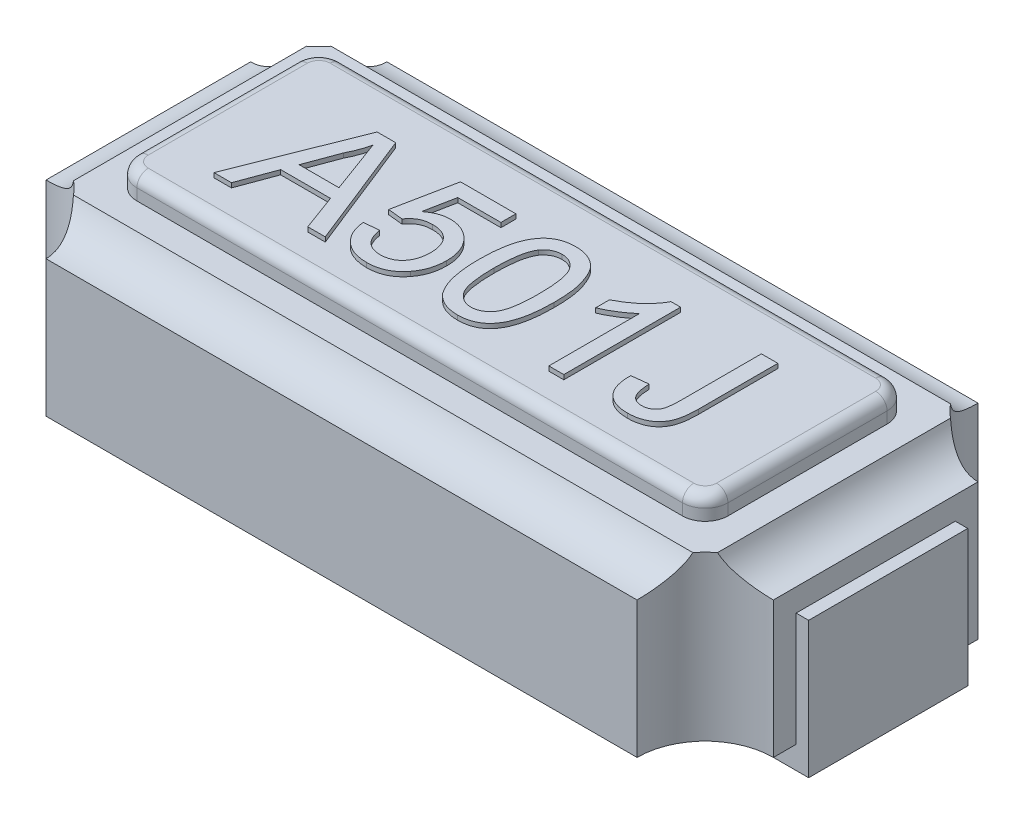
from build123d import *

# Parameters (mm, degrees)
EXTRUDE_1_DEPTH        = 0.8
EXTRUDE_START          = -1.6
SKETCH_3_R             = 0.2
EXTRUDE_4_DEPTH        = 3.2
EXTRUDE_START_2        = -0.75
SKETCH_4_R             = 0.2
EXTRUDE_5_DEPTH        = 1.5
PATTERN_LINEAR_3_COUNT = 2
PATTERN_LINEAR_3_PITCH = 1.5
PATTERN_LINEAR_4_COUNT = 2
PATTERN_LINEAR_4_PITCH = 3.2
SKETCH_5_W             = 0.8
SKETCH_5_H             = 0.7
EXTRUDE_6_DEPTH        = 0.6
EXTRUDE_6_2_DEPTH      = 0.6
SKETCH_5_2_W           = 0.8
SKETCH_5_2_H           = 0.7
EXTRUDE_7_DEPTH        = 0.6
EXTRUDE_7_2_DEPTH      = 0.6
SKETCH_6_W             = 2.9
SKETCH_6_H             = 1.2
EXTRUDE_8_DEPTH        = 0.08
EXTRUDE_9_DEPTH        = 0.1
EXTRUDE_10_DEPTH       = 0.02
EXTRUDE_10_2_DEPTH     = 0.02
EXTRUDE_10_3_DEPTH     = 0.02
EXTRUDE_10_4_DEPTH     = 0.02
EXTRUDE_10_5_DEPTH     = 0.02
FILLET_1_R             = 0.05


with BuildPart() as part:
    # Эскиз1 → Бобышка-Вытянуть1 (new body)
    with BuildSketch(Plane(origin=(0, 0.1, 0), x_dir=(1, 0, 0), z_dir=(0, 1, 0))):
        with BuildLine():
            Line((-1.3, 0.75), (1.3, 0.75))
            ThreePointArc((1.3, 0.75), (1.387867966, 0.537867966), (1.6, 0.45))
            Line((1.6, 0.45), (1.6, -0.45))
            ThreePointArc((1.6, -0.45), (1.387867966, -0.537867966), (1.3, -0.75))
            Line((1.3, -0.75), (-1.3, -0.75))
            ThreePointArc((-1.3, -0.75), (-1.387867966, -0.537867966), (-1.6, -0.45))
            Line((-1.6, -0.45), (-1.6, 0.45))
            ThreePointArc((-1.6, 0.45), (-1.387867966, 0.537867966), (-1.3, 0.75))
        make_face()
    extrude(amount=EXTRUDE_1_DEPTH)


with BuildPart() as body_2:
    # Эскиз3 → Бобышка-Вытянуть4 (new body)
    with BuildSketch(Plane(origin=(0, 0, 0), x_dir=(0, 0, -1), z_dir=(1, 0, 0)).offset(EXTRUDE_START)):
        with Locations((-0.75, 0.9)):
            Circle(SKETCH_3_R)
    extrude_4 = extrude(amount=EXTRUDE_4_DEPTH)


with BuildPart() as body_3:
    # Эскиз4 → Бобышка-Вытянуть5 (new body)
    with BuildSketch(Plane.XY.offset(EXTRUDE_START_2)):
        with Locations((1.6, 0.9)):
            Circle(SKETCH_4_R)
    extrude_5 = extrude(amount=EXTRUDE_5_DEPTH)


with BuildPart() as pattern_linear_3_1:
    # Линейный массив3: Бобышка-Вытянуть4 ×2
    with Locations(*[(0, 0, -i * PATTERN_LINEAR_3_PITCH) for i in range(1, PATTERN_LINEAR_3_COUNT)]):
        add(extrude_4)


with BuildPart() as pattern_linear_4_1:
    # Линейный массив4: Бобышка-Вытянуть5 ×2
    with Locations(*[(-i * PATTERN_LINEAR_4_PITCH, 0, 0) for i in range(1, PATTERN_LINEAR_4_COUNT)]):
        add(extrude_5)


with BuildPart() as part_1:
    add(part.part)

    # Combine 1: cut body 2, Линейный массив4_1, Линейный массив3_1, body 3
    add(body_2.part, mode=Mode.SUBTRACT)
    add(pattern_linear_4_1.part, mode=Mode.SUBTRACT)
    add(pattern_linear_3_1.part, mode=Mode.SUBTRACT)
    add(body_3.part, mode=Mode.SUBTRACT)


with BuildPart() as body_2_2:
    # Эскиз5 → Бобышка-Вытянуть6 (new body)
    with BuildSketch(Plane(origin=(0, 0, 0), x_dir=(1, 0, 0), z_dir=(0, 1, 0))):
        with Locations((1.255, 0)):
            Rectangle(SKETCH_5_W, SKETCH_5_H)
    extrude(amount=EXTRUDE_6_DEPTH)


with BuildPart() as body_3_2:
    # Эскиз5 → Extrude 6 2 (new body)
    with BuildSketch(Plane(origin=(0, 0, 0), x_dir=(1, 0, 0), z_dir=(0, 1, 0))):
        with Locations((-1.255, 0)):
            Rectangle(SKETCH_5_W, SKETCH_5_H)
    extrude(amount=EXTRUDE_6_2_DEPTH)


with BuildPart() as part_2:
    add(part_1.part)

    # Combine 2: cut body 3 2, body 2 2
    add(body_3_2.part, mode=Mode.SUBTRACT)
    add(body_2_2.part, mode=Mode.SUBTRACT)


with BuildPart() as body_2_3:
    # Эскиз5<2> → Бобышка-Вытянуть7 (new body)
    with BuildSketch(Plane(origin=(0, 0, 0), x_dir=(1, 0, 0), z_dir=(0, 1, 0))):
        with Locations((1.255, 0)):
            Rectangle(SKETCH_5_2_W, SKETCH_5_2_H)
    extrude(amount=EXTRUDE_7_DEPTH)


with BuildPart() as body_3_3:
    # Эскиз5<2> → Extrude 7 2 (new body)
    with BuildSketch(Plane(origin=(0, 0, 0), x_dir=(1, 0, 0), z_dir=(0, 1, 0))):
        with Locations((-1.255, 0)):
            Rectangle(SKETCH_5_2_W, SKETCH_5_2_H)
    extrude(amount=EXTRUDE_7_2_DEPTH)


with BuildPart() as body_4:
    # Эскиз6 → Бобышка-Вытянуть8 (new body)
    with BuildSketch(Plane(origin=(0, 0.9, 0), x_dir=(1, 0, 0), z_dir=(0, 1, 0))):
        Rectangle(SKETCH_6_W, SKETCH_6_H)
    extrude(amount=-EXTRUDE_8_DEPTH)


with BuildPart() as part_3:
    add(part_2.part)

    # Combine 3: cut body 4
    add(body_4.part, mode=Mode.SUBTRACT)


with BuildPart() as body_4_2:
    # Эскиз7 → Бобышка-Вытянуть9 (new body)
    with BuildSketch(Plane(origin=(0, 0.82, 0), x_dir=(1, 0, 0), z_dir=(0, 1, 0))):
        with BuildLine():
            Line((-1.2, 0.45), (1.2, 0.45))
            ThreePointArc((1.2, 0.45), (1.270710678, 0.420710678), (1.3, 0.35))
            Line((1.3, 0.35), (1.3, -0.35))
            ThreePointArc((1.3, -0.35), (1.270710678, -0.420710678), (1.2, -0.45))
            Line((1.2, -0.45), (-1.2, -0.45))
            ThreePointArc((-1.2, -0.45), (-1.270710678, -0.420710678), (-1.3, -0.35))
            Line((-1.3, -0.35), (-1.3, 0.35))
            ThreePointArc((-1.3, 0.35), (-1.270710678, 0.420710678), (-1.2, 0.45))
        make_face()
    extrude(amount=EXTRUDE_9_DEPTH)

    # Скругление1
    fillet_1_edges = [body_4_2.edges().sort_by_distance(p)[0] for p in [
        (-1.3, 0.92, 0),
        (-1.270710678, 0.92, -0.420710678),
        (0, 0.92, -0.45),
        (1.270710678, 0.92, -0.420710678),
        (1.3, 0.92, 0),
        (1.270710678, 0.92, 0.420710678),
        (0, 0.92, 0.45),
        (-1.270710678, 0.92, 0.420710678),
    ]]
    fillet(fillet_1_edges, radius=FILLET_1_R)


with BuildPart() as body_5:
    # Эскиз8 → Бобышка-Вытянуть10 (new body)
    with BuildSketch(Plane(origin=(0, 0.92, 0), x_dir=(1, 0, 0), z_dir=(0, 1, 0))):
        Polygon((-1.018581196, -0.292372642), (-0.814638583, 0.221291095), (-0.732938061, 0.221291095), (-0.528995447, -0.292372642), (-0.605859792, -0.292372642), (-0.664305506, -0.134322262), (-0.883271137, -0.134322262), (-0.941716851, -0.292372642), align=None)
        with BuildLine():
            Line((-0.861456892, -0.075053369), (-0.686119751, -0.075053369))
            Line((-0.686119751, -0.075053369), (-0.736024982, 0.059947998))
            add(Edge.make_bspline(
                [(-0.736024982, 0.059947998), (-0.73793817, 0.065164267), (-0.741678815, 0.075363057), (-0.747257243, 0.090181039), (-0.752353605, 0.104252802), (-0.757351006, 0.117376579), (-0.761862249, 0.129743004), (-0.766020378, 0.141268549), (-0.770132732, 0.151873106), (-0.772600614, 0.158724742), (-0.773788322, 0.162022202)],
                knots=[0, 0, 0, 0, 1.225184869, 2.395467751, 3.491410812, 4.525364584, 5.492066482, 6.394148129, 7.227157926, 8, 8, 8, 8], degree=3))
            add(Edge.make_bspline(
                [(-0.773788322, 0.162022202), (-0.77575302, 0.153890956), (-0.779690516, 0.137594935), (-0.787934676, 0.113719079), (-0.797365709, 0.090061578), (-0.805024831, 0.074816846), (-0.808876329, 0.067150815)],
                knots=[0, 0, 0, 0, 0.9891762, 1.982431084, 2.985436691, 4, 4, 4, 4], degree=3))
            Line((-0.808876329, 0.067150815), (-0.861456892, -0.075053369))
        make_face(mode=Mode.SUBTRACT)
    extrude(amount=EXTRUDE_10_DEPTH)


with BuildPart() as body_6:
    # Эскиз8 → Extrude 10 2 (new body)
    with BuildSketch(Plane(origin=(0, 0.92, 0), x_dir=(1, 0, 0), z_dir=(0, 1, 0))):
        with BuildLine():
            Line((-0.500492872, -0.154078559), (-0.434638547, -0.147493127))
            add(Edge.make_bspline(
                [(-0.434638547, -0.147493127), (-0.433986485, -0.151203656), (-0.432718125, -0.158421214), (-0.430301124, -0.168868843), (-0.427162128, -0.178574982), (-0.42363512, -0.187623692), (-0.419442676, -0.195919294), (-0.414900128, -0.203592772), (-0.409543121, -0.210371741), (-0.403910948, -0.216610748), (-0.397729207, -0.222108416), (-0.39093825, -0.22674314), (-0.383727549, -0.230786655), (-0.37600928, -0.234097307), (-0.367771613, -0.236520529), (-0.359119394, -0.238436882), (-0.349941207, -0.239402523), (-0.343678993, -0.239592407), (-0.340487441, -0.239689182)],
                knots=[0, 0, 0, 0, 1.237781394, 2.407677316, 3.51963579, 4.58689595, 5.594855907, 6.570874, 7.510833816, 8.428091223, 9.330271693, 10.221190844, 11.124215526, 12.043132878, 12.973586933, 13.941700858, 14.950982896, 16, 16, 16, 16], degree=3))
            add(Edge.make_bspline(
                [(-0.340487441, -0.239689182), (-0.336572121, -0.239594577), (-0.328915543, -0.239409571), (-0.317776672, -0.237844872), (-0.307255106, -0.235264864), (-0.297401189, -0.231654335), (-0.288099404, -0.227164214), (-0.279658331, -0.221350326), (-0.271617716, -0.214814941), (-0.264494975, -0.207023508), (-0.25801128, -0.198541232), (-0.252415364, -0.189282467), (-0.247704393, -0.179377167), (-0.24373827, -0.168827231), (-0.240809578, -0.15757239), (-0.238655288, -0.145672519), (-0.23727232, -0.133120038), (-0.237142084, -0.124516399), (-0.237075571, -0.120122423)],
                knots=[0, 0, 0, 0, 1.052816602, 2.058828735, 3.018813999, 3.961574988, 4.877590722, 5.788574389, 6.712363302, 7.658909047, 8.620312049, 9.580784896, 10.562948504, 11.56722449, 12.607883026, 13.686460295, 14.818448981, 16, 16, 16, 16], degree=3))
            add(Edge.make_bspline(
                [(-0.237075571, -0.120122423), (-0.237151169, -0.115935021), (-0.237298375, -0.107781178), (-0.238538091, -0.095907826), (-0.240629637, -0.084743283), (-0.243335903, -0.074164495), (-0.247066149, -0.064336768), (-0.251490431, -0.055117611), (-0.256910362, -0.046702681), (-0.262940393, -0.038829967), (-0.269827449, -0.031772396), (-0.277664575, -0.025813172), (-0.286144323, -0.020597647), (-0.295437485, -0.016368181), (-0.305549533, -0.013225847), (-0.31637998, -0.010808104), (-0.32804121, -0.00953647), (-0.336060219, -0.00931354), (-0.340178749, -0.009199044)],
                knots=[0, 0, 0, 0, 1.165854935, 2.270189951, 3.319242023, 4.32700288, 5.306253956, 6.24172124, 7.169108591, 8.088047231, 8.999810445, 9.905349262, 10.822648491, 11.767237767, 12.739852311, 13.766490849, 14.852878837, 16, 16, 16, 16], degree=3))
            add(Edge.make_bspline(
                [(-0.340178749, -0.009199044), (-0.345299941, -0.009348848), (-0.355121229, -0.00963614), (-0.369233409, -0.012053024), (-0.382080238, -0.015957191), (-0.393516264, -0.021775877), (-0.403733788, -0.028727254), (-0.412945074, -0.036593052), (-0.421226077, -0.045367953), (-0.425768545, -0.051974436), (-0.428053114, -0.055297071)],
                knots=[0, 0, 0, 0, 1.182877094, 2.268490576, 3.298955169, 4.273890847, 5.221533034, 6.149304476, 7.069219215, 8, 8, 8, 8], degree=3))
            Line((-0.428053114, -0.055297071), (-0.493907439, -0.048711639))
            Line((-0.493907439, -0.048711639), (-0.441223979, 0.214705662))
            Line((-0.441223979, 0.214705662), (-0.197562976, 0.214705662))
            Line((-0.197562976, 0.214705662), (-0.197562976, 0.148851337))
            Line((-0.197562976, 0.148851337), (-0.387408648, 0.148851337))
            Line((-0.387408648, 0.148851337), (-0.413544583, 0.015805021))
            add(Edge.make_bspline(
                [(-0.413544583, 0.015805021), (-0.409910918, 0.018531774), (-0.402774974, 0.023886686), (-0.391644181, 0.030898238), (-0.380354229, 0.036808509), (-0.36897084, 0.041648523), (-0.35740359, 0.045418886), (-0.345722283, 0.04803836), (-0.333887145, 0.049808755), (-0.325950987, 0.04998257), (-0.321965912, 0.050069849)],
                knots=[0, 0, 0, 0, 1.093835215, 2.148119334, 3.164235237, 4.159999629, 5.123971815, 6.089888814, 7.040853737, 8, 8, 8, 8], degree=3))
            add(Edge.make_bspline(
                [(-0.321965912, 0.050069849), (-0.316779607, 0.049933964), (-0.306566515, 0.049666373), (-0.291517169, 0.047467775), (-0.277127464, 0.043735509), (-0.263284526, 0.038708691), (-0.250170892, 0.032044785), (-0.237653729, 0.02397621), (-0.225783574, 0.014436459), (-0.214627532, 0.003605527), (-0.204508558, -0.008417947), (-0.195451746, -0.021241832), (-0.188054637, -0.035122828), (-0.18183316, -0.0496985), (-0.177140789, -0.065208112), (-0.173579116, -0.081431553), (-0.171674808, -0.09857165), (-0.171374799, -0.110240067), (-0.171221246, -0.116212322)],
                knots=[0, 0, 0, 0, 0.991958705, 1.953407265, 2.902004973, 3.832128134, 4.765371166, 5.71007953, 6.676509202, 7.674246545, 8.68000108, 9.679398714, 10.671856529, 11.683459888, 12.706765812, 13.76733029, 14.85725088, 16, 16, 16, 16], degree=3))
            add(Edge.make_bspline(
                [(-0.171221246, -0.116212322), (-0.171337847, -0.121910835), (-0.171568168, -0.133167025), (-0.173455697, -0.149755101), (-0.176564952, -0.165739018), (-0.180727387, -0.181166109), (-0.186351394, -0.19594876), (-0.193172789, -0.210134721), (-0.201041651, -0.223872017), (-0.20735207, -0.232340267), (-0.210528046, -0.236602261)],
                knots=[0, 0, 0, 0, 1.059692978, 2.093196008, 3.100373587, 4.086253034, 5.061402885, 6.037282833, 7.012182238, 8, 8, 8, 8], degree=3))
            add(Edge.make_bspline(
                [(-0.210528046, -0.236602261), (-0.214563035, -0.241577348), (-0.222500292, -0.25136388), (-0.236243566, -0.264066212), (-0.25101778, -0.274861447), (-0.266910857, -0.283631792), (-0.283816103, -0.290679508), (-0.301941193, -0.295369498), (-0.321067117, -0.298519012), (-0.334197435, -0.298809707), (-0.340899031, -0.298958075)],
                knots=[0, 0, 0, 0, 1.023140956, 2.012628108, 2.982342558, 3.942221589, 4.908720554, 5.902469194, 6.929439212, 8, 8, 8, 8], degree=3))
            add(Edge.make_bspline(
                [(-0.340899031, -0.298958075), (-0.346426784, -0.298845945), (-0.357240179, -0.298626597), (-0.373072913, -0.29671969), (-0.388131715, -0.293678845), (-0.402421303, -0.289317333), (-0.415984728, -0.283806154), (-0.428664333, -0.276805066), (-0.440680158, -0.268796258), (-0.451767895, -0.25953298), (-0.461870267, -0.249200864), (-0.470922197, -0.238018824), (-0.478801189, -0.22597957), (-0.485503439, -0.213155142), (-0.491089455, -0.199557839), (-0.495362978, -0.185094853), (-0.498747964, -0.16990809), (-0.499905137, -0.159410395), (-0.500492872, -0.154078559)],
                knots=[0, 0, 0, 0, 1.108768375, 2.168973506, 3.19473529, 4.187459816, 5.162590879, 6.12651078, 7.088512529, 8.056012598, 9.019588496, 9.983680353, 10.938070192, 11.90157236, 12.88306954, 13.882379887, 14.924449348, 16, 16, 16, 16], degree=3))
        make_face()
    extrude(amount=EXTRUDE_10_2_DEPTH)


with BuildPart() as body_7:
    # Эскиз8 → Extrude 10 3 (new body)
    with BuildSketch(Plane(origin=(0, 0.92, 0), x_dir=(1, 0, 0), z_dir=(0, 1, 0))):
        with BuildLine():
            add(Edge.make_bspline(
                [(-0.10536692, -0.039039285), (-0.105300572, -0.031698558), (-0.105170624, -0.017321167), (-0.104364597, 0.00371554), (-0.102957339, 0.023693229), (-0.100856691, 0.042594551), (-0.09836913, 0.06046217), (-0.095135284, 0.077270587), (-0.091496738, 0.093057515), (-0.087131136, 0.107806497), (-0.082334768, 0.121644349), (-0.076893136, 0.134548871), (-0.070770561, 0.146506382), (-0.064267931, 0.157640888), (-0.057042933, 0.167779201), (-0.049531654, 0.177205843), (-0.041188219, 0.185575104), (-0.032359566, 0.193102325), (-0.022915691, 0.199744659), (-0.01290656, 0.205476191), (-0.002370687, 0.210536721), (0.00889273, 0.214346287), (0.020649865, 0.217451891), (0.032991219, 0.219736411), (0.045930392, 0.221083212), (0.054772497, 0.221221018), (0.059268893, 0.221291095)],
                knots=[0, 0, 0, 0, 1.514747001, 2.966751498, 4.343369068, 5.64627492, 6.890416844, 8.064737671, 9.177176366, 10.232018008, 11.237056675, 12.19799043, 13.119080079, 14.007588942, 14.855863561, 15.685992447, 16.491747269, 17.290132607, 18.077525251, 18.870243746, 19.668095604, 20.485086593, 21.319398728, 22.175900658, 23.072407314, 24, 24, 24, 24], degree=3))
            add(Edge.make_bspline(
                [(0.059268893, 0.221291095), (0.06586569, 0.221097154), (0.078825363, 0.220716148), (0.097746552, 0.217608739), (0.115578554, 0.212293036), (0.132309782, 0.205121924), (0.147654219, 0.196013232), (0.161357448, 0.184940228), (0.173271658, 0.172019178), (0.183266823, 0.15709697), (0.192003595, 0.14058526), (0.199765151, 0.122409937), (0.206781373, 0.102591368), (0.211760236, 0.084850982), (0.215311656, 0.069536851), (0.217662413, 0.056906189), (0.219614013, 0.043277634), (0.221109202, 0.028684156), (0.22233597, 0.013142124), (0.223283346, -0.003358139), (0.223764237, -0.020857873), (0.223857005, -0.0328652), (0.223904706, -0.039039285)],
                knots=[0, 0, 0, 0, 1.134486744, 2.228744715, 3.287356444, 4.328707449, 5.352829806, 6.347195599, 7.349461267, 8.364207941, 9.428085653, 10.559314403, 11.761222316, 13.04268526, 13.726896727, 14.465273606, 15.252205015, 16.094778733, 16.988606776, 17.934225168, 18.937792761, 20, 20, 20, 20], degree=3))
            add(Edge.make_bspline(
                [(0.223904706, -0.039039285), (0.223837115, -0.046345531), (0.223705062, -0.06061972), (0.222920633, -0.081487748), (0.221428578, -0.101314715), (0.219592578, -0.12014604), (0.216815093, -0.137931451), (0.213822203, -0.154746515), (0.210120737, -0.170514875), (0.205801995, -0.185243443), (0.200938112, -0.199010099), (0.195604111, -0.211918882), (0.189696192, -0.223960973), (0.183038514, -0.235018918), (0.175935696, -0.245239494), (0.168335717, -0.254661039), (0.160077449, -0.263147952), (0.151169236, -0.270652595), (0.141791668, -0.277412721), (0.131758204, -0.283200841), (0.121112758, -0.287996198), (0.109926456, -0.29209599), (0.098085798, -0.295100077), (0.085684157, -0.297399659), (0.07267584, -0.298753819), (0.063799534, -0.29888905), (0.059268893, -0.298958075)],
                knots=[0, 0, 0, 0, 1.508974709, 2.94807912, 4.311757619, 5.615040294, 6.854280449, 8.028314546, 9.141715822, 10.197470207, 11.196696834, 12.155719058, 13.080757287, 13.963948316, 14.818758719, 15.649605906, 16.461113142, 17.260189315, 18.052359509, 18.845763934, 19.647754795, 20.461145776, 21.303032214, 22.167241874, 23.064524267, 24, 24, 24, 24], degree=3))
            add(Edge.make_bspline(
                [(0.059268893, -0.298958075), (0.053328697, -0.29878863), (0.041746951, -0.29845826), (0.024832665, -0.2962136), (0.008957705, -0.292262893), (-0.006011825, -0.286964438), (-0.019907663, -0.279877448), (-0.032796156, -0.271254742), (-0.04493629, -0.261296935), (-0.051924889, -0.253440454), (-0.05546169, -0.249464433)],
                knots=[0, 0, 0, 0, 1.10322584, 2.150986741, 3.161425019, 4.136713905, 5.093944212, 6.049774532, 7.013026876, 8, 8, 8, 8], degree=3))
            add(Edge.make_bspline(
                [(-0.05546169, -0.249464433), (-0.059532629, -0.243592044), (-0.06792708, -0.231482925), (-0.077752057, -0.210835755), (-0.08651611, -0.188106119), (-0.093394285, -0.162848065), (-0.098781611, -0.135262618), (-0.102672605, -0.105295651), (-0.104874525, -0.072960109), (-0.105199083, -0.050601474), (-0.10536692, -0.039039285)],
                knots=[0, 0, 0, 0, 0.779365345, 1.607084704, 2.489375761, 3.438383567, 4.461919411, 5.557722155, 6.737039282, 8, 8, 8, 8], degree=3))
        make_face()
        with BuildLine():
            add(Edge.make_bspline(
                [(-0.039512595, -0.03883349), (-0.039447207, -0.048713112), (-0.03932204, -0.067624894), (-0.038014345, -0.094643637), (-0.035763203, -0.119018231), (-0.032787046, -0.140714928), (-0.028857314, -0.159763078), (-0.02392307, -0.176114139), (-0.018361004, -0.189964361), (-0.011478052, -0.201142082), (-0.00394198, -0.210253555), (0.003838499, -0.218089717), (0.012046433, -0.224750275), (0.020628266, -0.230303822), (0.029717152, -0.234508603), (0.039213706, -0.237556237), (0.049119992, -0.239310104), (0.055866624, -0.239562102), (0.059268893, -0.239689182)],
                knots=[0, 0, 0, 0, 1.89448813, 3.626469325, 5.185477471, 6.587276848, 7.82441448, 8.910550357, 9.859733512, 10.6775885, 11.416198291, 12.123144072, 12.791880183, 13.439617036, 14.078171869, 14.70637855, 15.347637704, 16, 16, 16, 16], degree=3))
            add(Edge.make_bspline(
                [(0.059268893, -0.239689182), (0.06267031, -0.239559325), (0.069415252, -0.239301821), (0.079344428, -0.237586629), (0.088804032, -0.234382104), (0.097879367, -0.230192174), (0.106523575, -0.224765209), (0.114691198, -0.218079493), (0.122512663, -0.210247984), (0.130014883, -0.201030607), (0.136845396, -0.189801208), (0.1425118, -0.175962268), (0.147369146, -0.159582571), (0.151320442, -0.140544127), (0.154308876, -0.118881733), (0.156546407, -0.094574743), (0.157862853, -0.067590764), (0.157985955, -0.048713157), (0.158050381, -0.03883349)],
                knots=[0, 0, 0, 0, 0.652509534, 1.29391342, 1.924290653, 2.562989607, 3.207355802, 3.876242846, 4.583348185, 5.32723334, 6.150888545, 7.094226006, 8.186903555, 9.424320409, 10.81992305, 12.379283064, 14.105084285, 16, 16, 16, 16], degree=3))
            add(Edge.make_bspline(
                [(0.158050381, -0.03883349), (0.157988018, -0.029159387), (0.157868533, -0.010624173), (0.156518134, 0.015874054), (0.154401938, 0.03983953), (0.151507317, 0.061294351), (0.147660367, 0.080215225), (0.142994542, 0.09664243), (0.137434513, 0.110540934), (0.130823658, 0.122050347), (0.123464455, 0.131491188), (0.115777069, 0.139663057), (0.107569315, 0.146612966), (0.098695777, 0.152188285), (0.089442466, 0.156686246), (0.079596764, 0.159781856), (0.069255446, 0.161683703), (0.062158333, 0.16190808), (0.058548611, 0.162022202)],
                knots=[0, 0, 0, 0, 1.850066095, 3.544656626, 5.0727657, 6.45041401, 7.682899467, 8.762389858, 9.712573485, 10.538438529, 11.291566246, 11.996865408, 12.681389046, 13.341983376, 13.996294293, 14.643563182, 15.31009126, 16, 16, 16, 16], degree=3))
            add(Edge.make_bspline(
                [(0.058548611, 0.162022202), (0.055146556, 0.161932912), (0.048438139, 0.161756842), (0.038616138, 0.160076261), (0.029307943, 0.157265954), (0.020406913, 0.153459122), (0.012135256, 0.148335876), (0.004164939, 0.142354123), (-0.003130738, 0.135066024), (-0.007527049, 0.129617555), (-0.009775251, 0.126831297)],
                knots=[0, 0, 0, 0, 1.021318143, 2.013908504, 2.982026795, 3.937174072, 4.91255697, 5.897578595, 6.924855925, 8, 8, 8, 8], degree=3))
            add(Edge.make_bspline(
                [(-0.009775251, 0.126831297), (-0.012222857, 0.122739147), (-0.017391686, 0.114097387), (-0.023175305, 0.099077652), (-0.028284325, 0.081912954), (-0.032490743, 0.062339201), (-0.035533791, 0.040389971), (-0.037936159, 0.016090753), (-0.0391841, -0.010592377), (-0.039400076, -0.029160059), (-0.039512595, -0.03883349)],
                knots=[0, 0, 0, 0, 0.671104906, 1.417232262, 2.260109084, 3.195198885, 4.23592645, 5.382417421, 6.636286093, 8, 8, 8, 8], degree=3))
        make_face(mode=Mode.SUBTRACT)
    extrude(amount=EXTRUDE_10_3_DEPTH)


with BuildPart() as body_8:
    # Эскиз8 → Extrude 10 4 (new body)
    with BuildSketch(Plane(origin=(0, 0.92, 0), x_dir=(1, 0, 0), z_dir=(0, 1, 0))):
        with BuildLine():
            Line((0.52024917, -0.292372642), (0.454394844, -0.292372642))
            Line((0.454394844, -0.292372642), (0.454394844, 0.107898178))
            add(Edge.make_bspline(
                [(0.454394844, 0.107898178), (0.450602946, 0.10424136), (0.442721902, 0.096641062), (0.42939983, 0.085884743), (0.414530694, 0.074982758), (0.398307581, 0.064499281), (0.381770861, 0.054630217), (0.36579025, 0.045754512), (0.350632552, 0.038243512), (0.340648095, 0.034136467), (0.335857059, 0.032165704)],
                knots=[0, 0, 0, 0, 0.893362401, 1.856755847, 2.901947673, 4.020460078, 5.132200827, 6.168787962, 7.121294059, 8, 8, 8, 8], degree=3))
            Line((0.335857059, 0.032165704), (0.335857059, 0.092875161))
            add(Edge.make_bspline(
                [(0.335857059, 0.092875161), (0.344086158, 0.097113163), (0.360305225, 0.105466015), (0.383219259, 0.119892538), (0.404611975, 0.135531484), (0.424129238, 0.152379388), (0.441625221, 0.169600971), (0.45636934, 0.186978225), (0.46870628, 0.203874174), (0.474895957, 0.215657225), (0.477855448, 0.221291095)],
                knots=[0, 0, 0, 0, 1.141258006, 2.249351951, 3.335817539, 4.406819942, 5.426913362, 6.360259544, 7.215985427, 8, 8, 8, 8], degree=3))
            Line((0.477855448, 0.221291095), (0.52024917, 0.221291095))
            Line((0.52024917, 0.221291095), (0.52024917, -0.292372642))
        make_face()
    extrude(amount=EXTRUDE_10_4_DEPTH)


with BuildPart() as body_9:
    # Эскиз8 → Extrude 10 5 (new body)
    with BuildSketch(Plane(origin=(0, 0.92, 0), x_dir=(1, 0, 0), z_dir=(0, 1, 0))):
        with BuildLine():
            Line((0.671714118, -0.149036587), (0.744153875, -0.140907694))
            add(Edge.make_bspline(
                [(0.744153875, -0.140907694), (0.744349595, -0.145472303), (0.744724002, -0.15420428), (0.745965304, -0.166740231), (0.747698129, -0.178141986), (0.749843959, -0.188451185), (0.752343805, -0.197674984), (0.755480274, -0.205738966), (0.758858228, -0.212812559), (0.76301147, -0.218675721), (0.767464459, -0.223686686), (0.772363136, -0.227941467), (0.777644306, -0.231567118), (0.783297444, -0.234562185), (0.789386154, -0.236859537), (0.795847143, -0.238455357), (0.802733672, -0.239560105), (0.807465432, -0.239645268), (0.809905303, -0.239689182)],
                knots=[0, 0, 0, 0, 1.632619403, 3.123158228, 4.499702462, 5.75227728, 6.885496867, 7.90993266, 8.841891104, 9.678429245, 10.468404694, 11.232957398, 11.991194639, 12.753385178, 13.513799276, 14.310593147, 15.128879333, 16, 16, 16, 16], degree=3))
            add(Edge.make_bspline(
                [(0.809905303, -0.239689182), (0.813452563, -0.239570473), (0.820383907, -0.239338515), (0.830326103, -0.236954534), (0.839589831, -0.233377727), (0.847913083, -0.22815506), (0.855333835, -0.221800093), (0.86164611, -0.214300836), (0.866454379, -0.205634086), (0.869482727, -0.19763231), (0.87134034, -0.190510344), (0.872556049, -0.184323341), (0.873580956, -0.177421073), (0.874355086, -0.169760279), (0.875141013, -0.161363185), (0.875454986, -0.152193087), (0.875820948, -0.14231677), (0.875848347, -0.135488896), (0.875862526, -0.131955622)],
                knots=[0, 0, 0, 0, 1.177507829, 2.300849353, 3.381033894, 4.466744326, 5.550475886, 6.619462111, 7.707386998, 8.830091395, 9.455333453, 10.153234525, 10.925888378, 11.774835866, 12.713513529, 13.729654905, 14.82514671, 16, 16, 16, 16], degree=3))
            Line((0.875862526, -0.131955622), (0.875862526, 0.221291095))
            Line((0.875862526, 0.221291095), (0.948302284, 0.221291095))
            Line((0.948302284, 0.221291095), (0.948302284, -0.12732524))
            add(Edge.make_bspline(
                [(0.948302284, -0.12732524), (0.948272691, -0.132539498), (0.948215423, -0.142630464), (0.947493278, -0.157323255), (0.94623731, -0.171115636), (0.944659593, -0.184037864), (0.942495415, -0.196062631), (0.939818144, -0.207149821), (0.936784125, -0.217389462), (0.932022077, -0.229610603), (0.92477162, -0.243475694), (0.91367713, -0.258180677), (0.900267747, -0.270725098), (0.884695493, -0.28104962), (0.867334064, -0.289017503), (0.848482771, -0.29480256), (0.828185198, -0.298382568), (0.814139235, -0.298762721), (0.806921279, -0.298958075)],
                knots=[0, 0, 0, 0, 0.979376435, 1.895351937, 2.762129694, 3.580429744, 4.339931879, 5.055623694, 5.722093767, 6.344240595, 7.517202841, 8.648554164, 9.788057829, 10.949533591, 12.142879013, 13.363546981, 14.645176409, 16, 16, 16, 16], degree=3))
            add(Edge.make_bspline(
                [(0.806921279, -0.298958075), (0.801564838, -0.298841057), (0.791131094, -0.29861312), (0.775962198, -0.296801176), (0.761708242, -0.294076116), (0.748546464, -0.289692834), (0.736209836, -0.284564315), (0.724937153, -0.277973038), (0.71453546, -0.270368097), (0.705268112, -0.26142345), (0.696911494, -0.251429666), (0.690001491, -0.240075329), (0.683894844, -0.227771246), (0.679284618, -0.214174711), (0.675503006, -0.199537886), (0.673163937, -0.183674021), (0.671627553, -0.166731518), (0.671684736, -0.15504264), (0.671714118, -0.149036587)],
                knots=[0, 0, 0, 0, 1.110149412, 2.162445788, 3.163771351, 4.112774839, 5.033433762, 5.928696445, 6.813333667, 7.698542325, 8.592646346, 9.506220098, 10.44759987, 11.434914499, 12.476633792, 13.577933972, 14.755478919, 16, 16, 16, 16], degree=3))
        make_face()
    extrude(amount=EXTRUDE_10_5_DEPTH)


solid = Compound([body_2_3.part, body_3_3.part, part_3.part, body_4_2.part, body_5.part, body_6.part, body_7.part, body_8.part, body_9.part])
